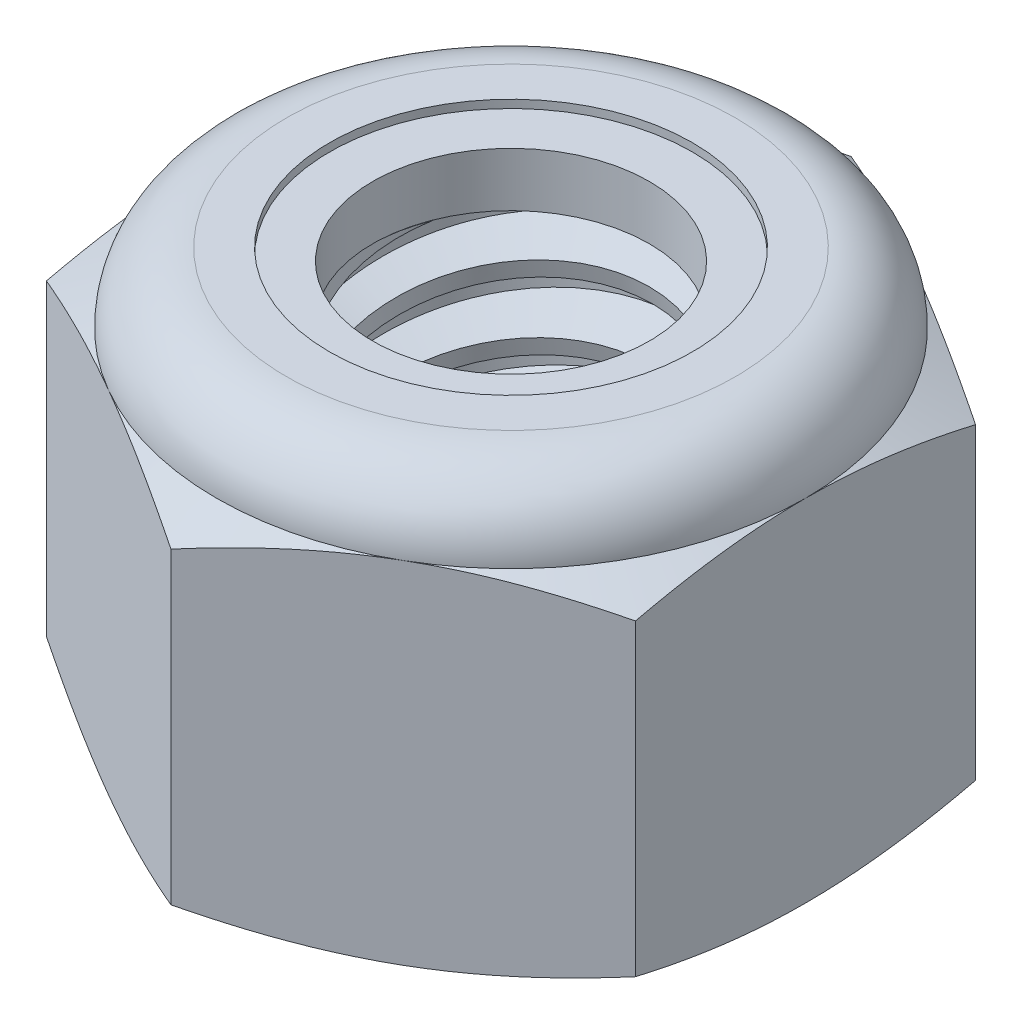
from build123d import *

# Parameters (mm, degrees)
EXTRUDE1_DEPTH      = 7.9375
SKETCH2_W           = 3.175
SKETCH2_H           = 7.9375
LPATTERN1_COUNT     = 6
LPATTERN1_PITCH     = 1.27
LPATTERN1_COL_COUNT = 2
LPATTERN1_COL_PITCH = 1.27


with BuildPart() as part:
    # Sketch1 → Extrude1 (new body)
    with BuildSketch(Plane(origin=(0, 0, 0), x_dir=(1, 0, 0), z_dir=(0, 1, 0))):
        Polygon((0, 6.415804866), (-5.55625, 3.207902433), (-5.55625, -3.207902433), (0, -6.415804866), (5.55625, -3.207902433), (5.55625, 3.207902433), align=None)
    extrude(amount=EXTRUDE1_DEPTH)

    # Sketch4 → Cut-Revolve2 (revolve, cut)
    with BuildSketch(Plane(origin=(0, 0, 0), x_dir=(0, 0, -1), z_dir=(1, 0, 0)), mode=Mode.PRIVATE) as cut_revolve2_sk:
        Polygon((0, 7.9375), (3.175, 7.9375), (2.609908356, 7.673993439), (2.609908356, 0.263506561), (3.175, 0), (0, 0), align=None)
    revolve(cut_revolve2_sk.sketch.rotate(Axis((0, 7.9375, 0), (0, 1, 0)), 54.49881281), axis=Axis((0, 7.9375, 0), (0, 1, 0)), mode=Mode.SUBTRACT)


with BuildPart() as body_2:
    # Sketch2 → Revolve1 (revolve)
    with BuildSketch(Plane(origin=(0, 0, 0), x_dir=(0, 0, -1), z_dir=(1, 0, 0))):
        with Locations((1.5875, 3.96875)):
            Rectangle(SKETCH2_W, SKETCH2_H)
    revolve(axis=Axis((0, -3.175, 0), (0, 1, 0)))

    # Sketch3 → Cut-Revolve1 (revolve, cut)
    with BuildSketch(Plane(origin=(0, 0, 0), x_dir=(0, 0, -1), z_dir=(1, 0, 0)), mode=Mode.PRIVATE) as cut_revolve1_sk:
        Polygon((3.206133436, 7.781832818), (3.424067492, 6.692162542), (2.672175229, 6.946518763), (2.609908356, 7.257853128), align=None)
    cut_revolve1 = revolve(cut_revolve1_sk.sketch.rotate(Axis((0, 7.9375, 0.272704483), (0, -0.9805806756909201, -0.1961161351381845)), 180), axis=Axis((0, 7.9375, 0.272704483), (0, -0.9805806756909201, -0.1961161351381845)), mode=Mode.SUBTRACT)

    # LPattern1: Cut-Revolve1 ×6
    with Locations(*[(0, -i * LPATTERN1_PITCH, 0) for i in range(1, LPATTERN1_COUNT)]):
        add(cut_revolve1, mode=Mode.SUBTRACT)

    # LPattern1 col: Cut-Revolve1 ×2
    with Locations(*[(0, i * LPATTERN1_COL_PITCH, 0) for i in range(1, LPATTERN1_COL_COUNT)]):
        add(cut_revolve1, mode=Mode.SUBTRACT)


with BuildPart() as part_1:
    add(part.part)

    # Combine1: cut body 2
    add(body_2.part, mode=Mode.SUBTRACT)

    # Sketch5 → Cut-Revolve3 (revolve, cut)
    with BuildSketch(Plane(origin=(0, 0, 0), x_dir=(0, 0, -1), z_dir=(1, 0, 0)), mode=Mode.PRIVATE) as cut_revolve3_sk:
        with BuildLine():
            Line((0, 0), (5.55625, 0))
            Line((5.55625, 0), (6.415804866, 0.400817017))
            Line((6.415804866, 0.400817017), (6.415804866, 6.213766317))
            Line((6.415804866, 6.213766317), (5.55625, 6.614583333))
            ThreePointArc((5.55625, 6.614583333), (5.168776679, 7.550026679), (4.233333333, 7.9375))
            Line((4.233333333, 7.9375), (4.233333333, 9.2075))
            Line((4.233333333, 9.2075), (7.685804866, 9.2075))
            Line((7.685804866, 9.2075), (7.685804866, -1.27))
            Line((7.685804866, -1.27), (0, -1.27))
            Line((0, -1.27), (0, 0))
        make_face()
    revolve(cut_revolve3_sk.sketch.rotate(Axis((0, 0, 0), (0, 1, 0)), 54.619043446), axis=Axis((0, 0, 0), (0, 1, 0)), mode=Mode.SUBTRACT)

    # Sketch6 → Cut-Revolve4 (revolve, cut)
    with BuildSketch(Plane(origin=(0, 0, 0), x_dir=(0, 0, -1), z_dir=(1, 0, 0)), mode=Mode.PRIVATE) as cut_revolve4_sk:
        with BuildLine():
            Line((0, 6.614583333), (5.40385, 6.614583333))
            ThreePointArc((5.40385, 6.614583333), (5.061013606, 7.442263606), (4.233333333, 7.7851))
            Line((4.233333333, 7.7851), (3.421620845, 7.7851))
            Line((3.421620845, 7.7851), (3.421620845, 9.2075))
            Line((3.421620845, 9.2075), (0, 9.2075))
            Line((0, 9.2075), (0, 6.614583333))
        make_face()
    revolve(cut_revolve4_sk.sketch.rotate(Axis((0, 9.2075, 0), (0, 1, 0)), 54.49881281), axis=Axis((0, 9.2075, 0), (0, 1, 0)), mode=Mode.SUBTRACT)


with BuildPart() as body_2_2:
    # Sketch7 → Revolve2 (revolve)
    with BuildSketch(Plane(origin=(0, 0, 0), x_dir=(0, 0, -1), z_dir=(1, 0, 0))):
        with BuildLine():
            Line((2.609908356, 6.690783333), (5.324993778, 6.690783333))
            ThreePointArc((5.324993778, 6.690783333), (4.979705237, 7.4148695), (4.233333333, 7.7089))
            Line((4.233333333, 7.7089), (2.609908356, 7.7089))
            Line((2.609908356, 7.7089), (2.609908356, 6.690783333))
        make_face()
    revolve(axis=Axis((0, 6.690783333, 0), (0, 1, 0)))


solid = Compound([part_1.part, body_2_2.part])
